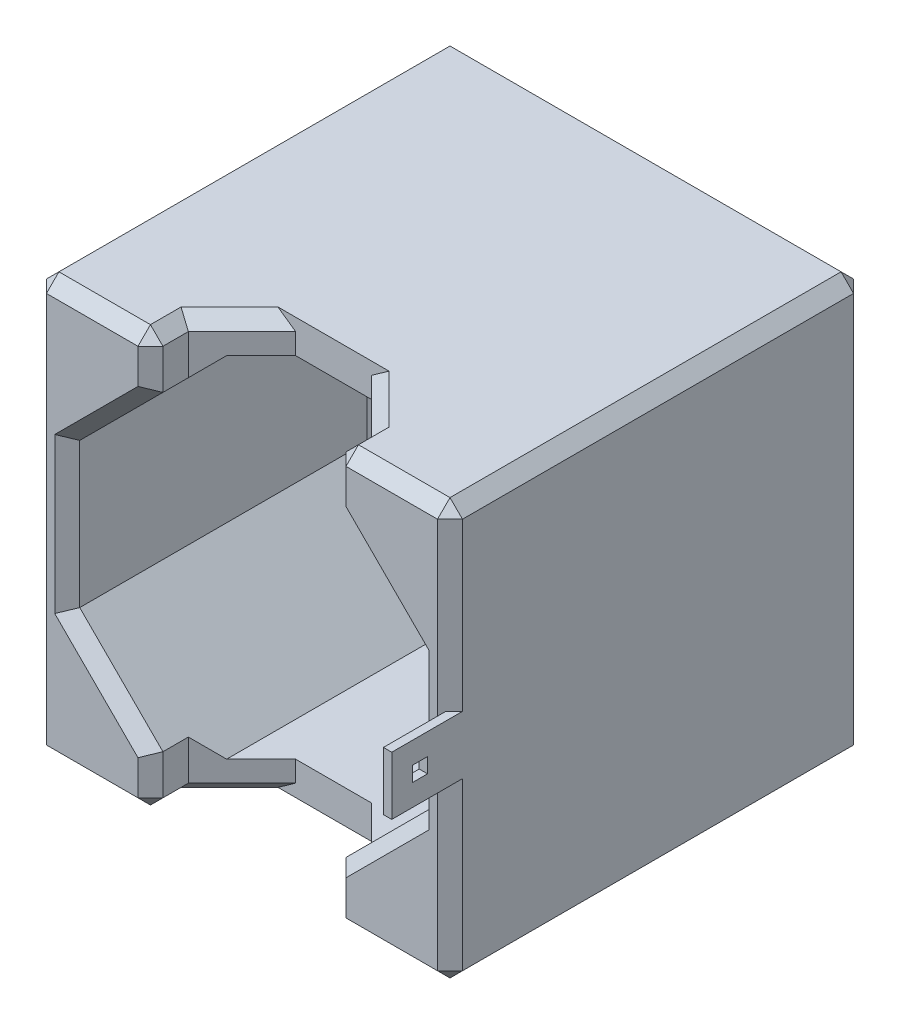
from build123d import *

# Parameters (mm, degrees)
SKETCH1_W                = 50
SKETCH1_H                = 50
BOSS_EXTRUDE1_DEPTH      = 50
CUT_EXTRUDE2_DEPTH       = 87.602540378
CUT_EXTRUDE3_DEPTH       = 40
CHAMFER1_SIZE            = 4
CHAMFER3_SIZE            = 1.5
BOSS_EXTRUDE2_DEPTH      = 7
BOSS_EXTRUDE2_DEPTH_BACK = 10
SKETCH5_W                = 1
SKETCH5_H                = 7
SKETCH6_W                = 1.8
SKETCH6_H                = 1.8
CUT_EXTRUDE4_DEPTH       = 7


with BuildPart() as part:
    # Sketch1 → Boss-Extrude1 (new body)
    with BuildSketch(Plane.XY):
        with Locations((25, 25)):
            Rectangle(SKETCH1_W, SKETCH1_H)
    extrude(amount=BOSS_EXTRUDE1_DEPTH)

    # Sketch3 → Cut-Extrude2 (cut, through all)
    with BuildSketch(Plane.XZ):
        Polygon((29.556349186, 39), (36, 45.443650814), (36, 54.556349186), (29.556349186, 61), (20.443650814, 61), (14, 54.556349186), (14, 45.443650814), (20.443650814, 39), align=None)
    extrude(amount=-CUT_EXTRUDE2_DEPTH, mode=Mode.SUBTRACT)

    # Sketch4 → Cut-Extrude3 (cut)
    with BuildSketch(Plane.XY.offset(50)):
        Polygon((33.69848481, 46), (16.30151519, 46), (4, 33.69848481), (4, 16.30151519), (16.30151519, 4), (33.69848481, 4), (46, 16.30151519), (46, 33.69848481), align=None)
    extrude(amount=-CUT_EXTRUDE3_DEPTH, mode=Mode.SUBTRACT)

    # Chamfer1
    chamfer1_edges = [part.edges().sort_by_distance(p)[0] for p in [
        (10.150757595, 10.150757595, 10),
        (10.150757595, 39.849242405, 10),
        (39.849242405, 39.849242405, 10),
        (39.849242405, 10.150757595, 10),
        (25, 4, 10),
        (25, 46, 10),
        (46, 25, 10),
        (4, 25, 10),
    ]]
    chamfer(chamfer1_edges, length=CHAMFER1_SIZE)

    # Chamfer3
    chamfer3_edges = [part.edges().sort_by_distance(p)[0] for p in [
        (50, 25, 50),
        (43, 50, 50),
        (43, 0, 50),
        (7, 50, 50),
        (36, 46.849242405, 50),
        (14, 3.150757595, 50),
        (14, 50, 47.721825407),
        (36, 50, 47.721825407),
        (36, 0, 47.721825407),
        (14, 0, 47.721825407),
        (17.221825407, 0, 42.221825407),
        (32.778174593, 0, 42.221825407),
        (17.221825407, 50, 42.221825407),
        (32.778174593, 50, 42.221825407),
        (0, 25, 50),
        (25, 50, 0),
        (50, 25, 0),
        (36, 3.150757595, 50),
        (14, 46.849242405, 50),
        (25, 0, 0),
        (9, 11.30151519, 50),
        (9, 38.69848481, 50),
        (4, 25, 50),
        (41, 38.69848481, 50),
        (0, 25, 0),
        (41, 11.30151519, 50),
        (46, 25, 50),
        (7, 0, 50),
        (0, 50, 25),
        (50, 50, 25),
        (50, 0, 25),
        (0, 0, 25),
    ]]
    chamfer(chamfer3_edges, length=CHAMFER3_SIZE)

    # Sketch5 → Boss-Extrude2 (add, two sides: drawn at the far end of the back side and taken through both)
    with BuildSketch(Plane.XY.offset(50).offset(-BOSS_EXTRUDE2_DEPTH_BACK)):
        with Locations((49.5, 25)):
            Rectangle(SKETCH5_W, SKETCH5_H)
    extrude(amount=BOSS_EXTRUDE2_DEPTH + BOSS_EXTRUDE2_DEPTH_BACK)

    # Sketch6 → Cut-Extrude4 (cut)
    with BuildSketch(Plane(origin=(50, 0, 0), x_dir=(0, 0, -1), z_dir=(1, 0, 0))):
        with Locations((-53.6, 25)):
            Rectangle(SKETCH6_W, SKETCH6_H)
    extrude(amount=-CUT_EXTRUDE4_DEPTH, mode=Mode.SUBTRACT)


solid = part.part
